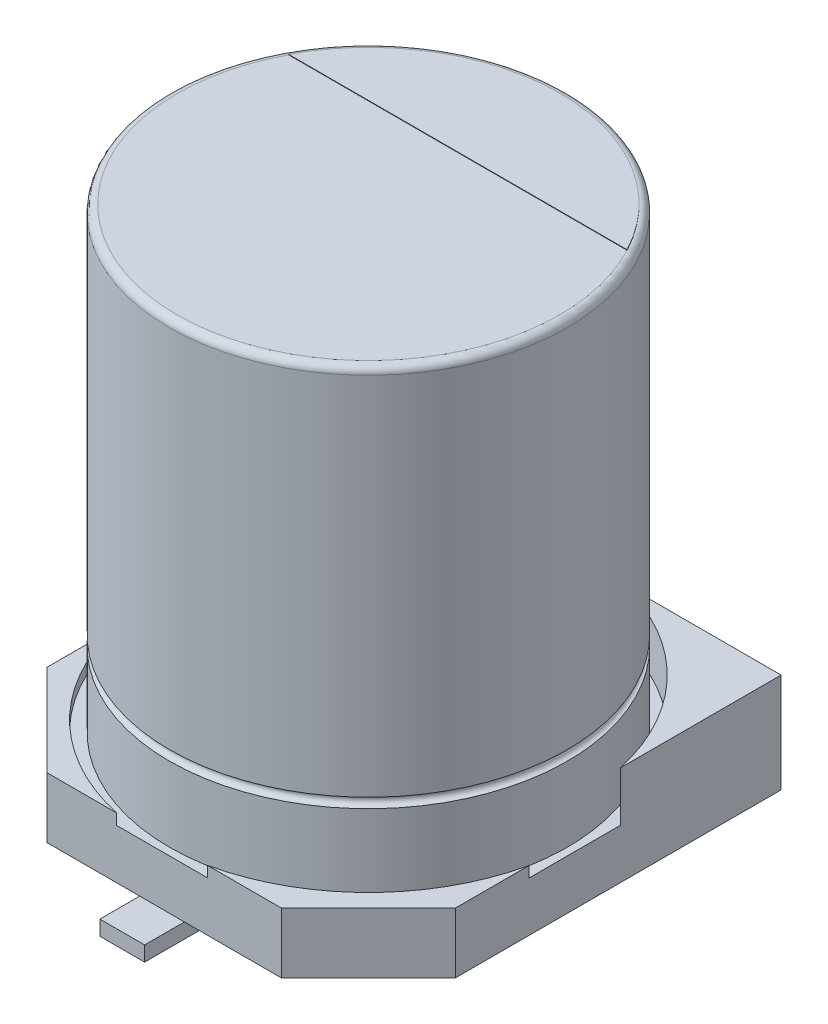
from build123d import *

# Parameters (mm, degrees)
BOSS_EXTRUDE1_DEPTH = 2
SKETCH2_R           = 4.25
CUT_EXTRUDE1_DEPTH  = 1
CUT_EXTRUDE4_START  = -8.3
SKETCH8_W           = 3.410115148
SKETCH8_H           = 1.095606144
CUT_EXTRUDE4_DEPTH  = 8.3
BOSS_EXTRUDE4_DEPTH = 0.01
SKETCH9_W           = 0.9
SKETCH9_H           = 3.4
BOSS_EXTRUDE5_DEPTH = 0.3


with BuildPart() as part:
    # Sketch1 → Boss-Extrude1 (new body)
    with BuildSketch(Plane(origin=(0, 0, 0), x_dir=(1, 0, 0), z_dir=(0, 1, 0))):
        Polygon((-4.15, 4.15), (4.15, 4.15), (4.15, -2.402631579), (2.402631579, -4.15), (-2.315263158, -4.15), (-4.15, -2.315263158), align=None)
    extrude(amount=BOSS_EXTRUDE1_DEPTH)

    # Sketch2 → Cut-Extrude1 (cut)
    with BuildSketch(Plane(origin=(0, 2, 0), x_dir=(1, 0, 0), z_dir=(0, 1, 0))):
        Circle(SKETCH2_R)
    extrude(amount=-CUT_EXTRUDE1_DEPTH, mode=Mode.SUBTRACT)

    # Sketch8 → Cut-Extrude4 (cut)
    with BuildSketch(Plane.ZY.offset(4.15).offset(CUT_EXTRUDE4_START)):
        with Locations((2.621572713, 1.765165498)):
            Rectangle(SKETCH8_W, SKETCH8_H)
    extrude(amount=CUT_EXTRUDE4_DEPTH, mode=Mode.SUBTRACT)

    # Sketch5 → Revolve1 (revolve)
    with BuildSketch(Plane.XY, mode=Mode.PRIVATE) as revolve1_sk:
        with BuildLine():
            Line((0, 1), (-4, 1))
            Line((-4, 1), (-4, 2.5))
            ThreePointArc((-4, 2.5), (-3.9, 2.6), (-4, 2.7))
            Line((-4, 2.7), (-4, 10.05))
            ThreePointArc((-4, 10.05), (-3.956066017, 10.156066017), (-3.85, 10.2))
            Line((-3.85, 10.2), (0, 10.2))
            Line((0, 10.2), (0, 1))
        make_face()
    revolve(revolve1_sk.sketch.rotate(Axis((0, 10.2, 0), (0, -1, 0)), 270), axis=Axis((0, 10.2, 0), (0, -1, 0)))

    # Sketch6 → Boss-Extrude4 (add)
    with BuildSketch(Plane(origin=(0, 10.2, 0), x_dir=(1, 0, 0), z_dir=(0, 1, 0))):
        with BuildLine():
            Line((-3.403621507, 1.799405635), (3.403621507, 1.799405635))
            ThreePointArc((3.403621507, 1.799405635), (0, 3.85), (-3.403621507, 1.799405635))
        make_face()
    extrude(amount=BOSS_EXTRUDE4_DEPTH)

    # Sketch9 → Boss-Extrude5 (add)
    with BuildSketch(Plane.XZ):
        with Locations((0, -3.25)):
            Rectangle(SKETCH9_W, SKETCH9_H)
        with Locations((0, 3.25)):
            Rectangle(SKETCH9_W, SKETCH9_H)
    extrude(amount=BOSS_EXTRUDE5_DEPTH)


solid = part.part
